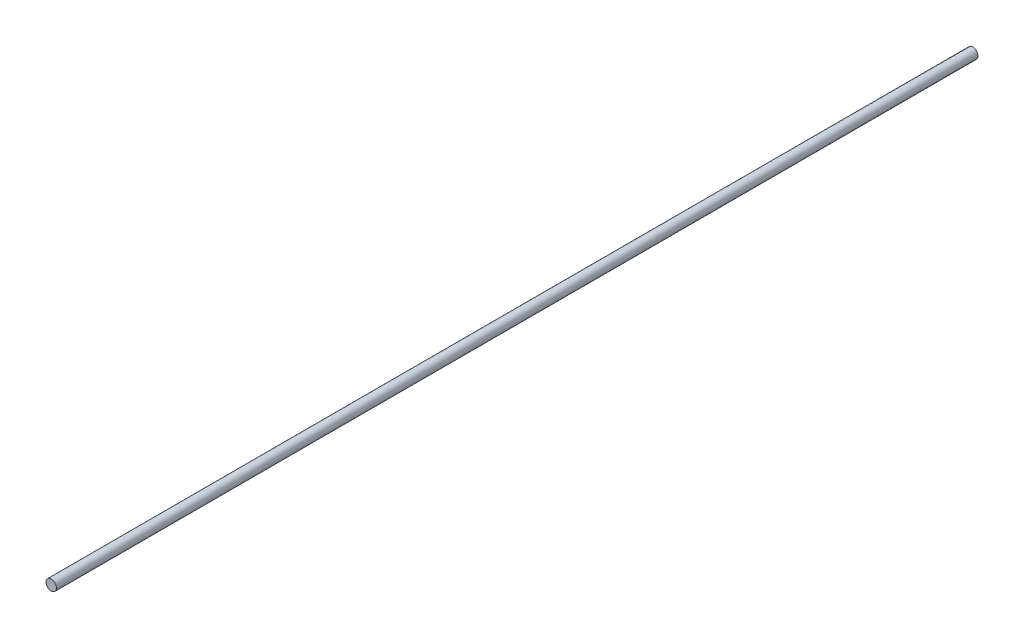
from build123d import *

# Parameters (mm, degrees)
SKETCH1_R           = 6.35
BOSS_EXTRUDE1_DEPTH = 1121.918


with BuildPart() as part:
    # Sketch1 → Boss-Extrude1 (new body)
    with BuildSketch(Plane.XY):
        Circle(SKETCH1_R)
    extrude(amount=BOSS_EXTRUDE1_DEPTH)


solid = part.part
